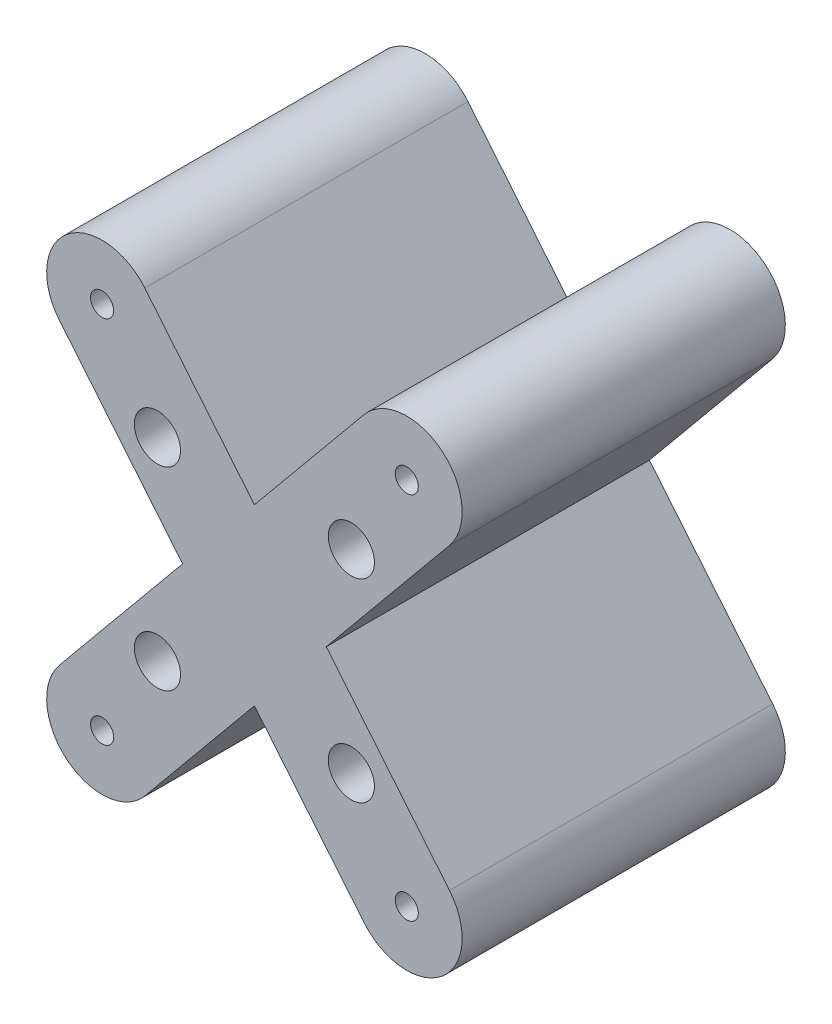
from build123d import *

# Parameters (mm, degrees)
SKETCH1_R           = 2.5
BOSS_EXTRUDE1_DEPTH = 70
SKETCH2_R           = 5
CUT_EXTRUDE1_DEPTH  = 60
SKETCH3_R           = 6
CUT_EXTRUDE2_DEPTH  = 65


with BuildPart() as part:
    # Sketch1 → Boss-Extrude1 (new body)
    with BuildSketch(Plane.XY):
        with BuildLine():
            Line((42.256479342, 32.363404542), (15.556670595, 0))
            Line((15.556670595, 0), (42.256479342, -32.363404542))
            ThreePointArc((42.256479342, -32.363404542), (40.636595458, -49.256479342), (23.743520658, -47.636595458))
            Line((23.743520658, -47.636595458), (0, -18.856570418))
            Line((0, -18.856570418), (-23.743520658, -47.636595458))
            ThreePointArc((-23.743520658, -47.636595458), (-40.636595458, -49.256479342), (-42.256479342, -32.363404542))
            Line((-42.256479342, -32.363404542), (-15.556670595, 0))
            Line((-15.556670595, 0), (-42.256479342, 32.363404542))
            ThreePointArc((-42.256479342, 32.363404542), (-40.636595458, 49.256479342), (-23.743520658, 47.636595458))
            Line((-23.743520658, 47.636595458), (0, 18.856570418))
            Line((0, 18.856570418), (23.743520658, 47.636595458))
            ThreePointArc((23.743520658, 47.636595458), (40.636595458, 49.256479342), (42.256479342, 32.363404542))
        make_face()
        with Locations((-33, 40)):
            Circle(SKETCH1_R, mode=Mode.SUBTRACT)
        with Locations((33, 40)):
            Circle(SKETCH1_R, mode=Mode.SUBTRACT)
        with Locations((-21, 21)):
            Circle(SKETCH1_R, mode=Mode.SUBTRACT)
        with Locations((21, 21)):
            Circle(SKETCH1_R, mode=Mode.SUBTRACT)
        with Locations((21, -21)):
            Circle(SKETCH1_R, mode=Mode.SUBTRACT)
        with Locations((-21, -21)):
            Circle(SKETCH1_R, mode=Mode.SUBTRACT)
        with Locations((-33, -40)):
            Circle(SKETCH1_R, mode=Mode.SUBTRACT)
        with Locations((33, -40)):
            Circle(SKETCH1_R, mode=Mode.SUBTRACT)
    extrude(amount=BOSS_EXTRUDE1_DEPTH)

    # Sketch2 → Cut-Extrude1 (cut)
    with BuildSketch(Plane.XY.offset(70)):
        with Locations((-21, -21)):
            Circle(SKETCH2_R)
        with Locations((-21, 21)):
            Circle(SKETCH2_R)
        with Locations((21, 21)):
            Circle(SKETCH2_R)
        with Locations((21, -21)):
            Circle(SKETCH2_R)
    extrude(amount=-CUT_EXTRUDE1_DEPTH, mode=Mode.SUBTRACT)

    # Sketch3 → Cut-Extrude2 (cut)
    with BuildSketch(Plane(origin=(0, 0, 0), x_dir=(-1, 0, 0), z_dir=(0, 0, -1))):
        with Locations((33, 40)):
            Circle(SKETCH3_R)
        with Locations((33, -40)):
            Circle(SKETCH3_R)
        with Locations((-33, 40)):
            Circle(SKETCH3_R)
        with Locations((-33, -40)):
            Circle(SKETCH3_R)
    extrude(amount=-CUT_EXTRUDE2_DEPTH, mode=Mode.SUBTRACT)


solid = part.part
